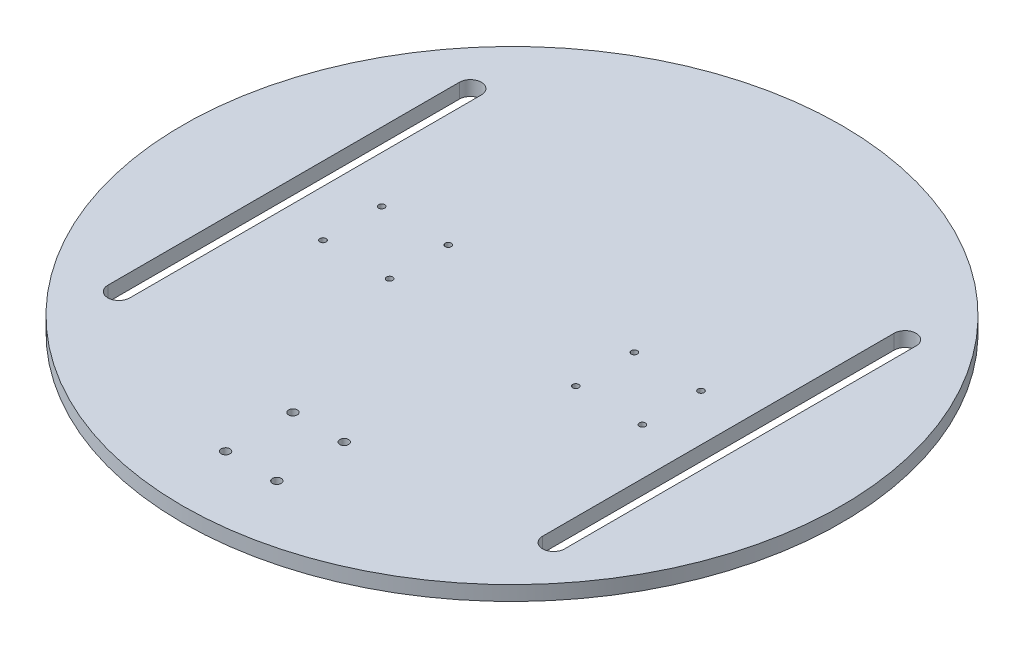
from build123d import *

# Parameters (mm, degrees)
SKETCH1_R           = 225
SKETCH1_R_2         = 3
BOSS_EXTRUDE1_DEPTH = 10
SKETCH3_R           = 2.1
CUT_EXTRUDE2_DEPTH  = 10


with BuildPart() as part:
    # Sketch1 → Boss-Extrude1 (new body)
    with BuildSketch(Plane(origin=(0, 0, 0), x_dir=(1, 0, 0), z_dir=(0, 1, 0))):
        with Locations(Location((0, 0, 0), (0, 0, 270))):
            Circle(SKETCH1_R)
        with Locations(Location((-17.5, -132.051038191, 0), (0, 0, 270))):
            Circle(SKETCH1_R_2, mode=Mode.SUBTRACT)
        with Locations(Location((17.5, -132.051038191, 0), (0, 0, 270))):
            Circle(SKETCH1_R_2, mode=Mode.SUBTRACT)
        with Locations(Location((17.5, -178.051038191, 0), (0, 0, 270))):
            Circle(SKETCH1_R_2, mode=Mode.SUBTRACT)
        with Locations(Location((-17.5, -178.051038191, 0), (0, 0, 270))):
            Circle(SKETCH1_R_2, mode=Mode.SUBTRACT)
        with BuildLine():
            Line((-155.90685468, -120), (-155.90685468, 120))
            ThreePointArc((-155.90685468, 120), (-148.40685468, 127.5), (-140.90685468, 120))
            Line((-140.90685468, 120), (-140.90685468, -120))
            ThreePointArc((-140.90685468, -120), (-148.40685468, -127.5), (-155.90685468, -120))
        make_face(mode=Mode.SUBTRACT)
        with BuildLine():
            Line((155.90685468, -120), (155.90685468, 120))
            ThreePointArc((155.90685468, 120), (148.40685468, 127.5), (140.90685468, 120))
            Line((140.90685468, 120), (140.90685468, -120))
            ThreePointArc((140.90685468, -120), (148.40685468, -127.5), (155.90685468, -120))
        make_face(mode=Mode.SUBTRACT)
    extrude(amount=BOSS_EXTRUDE1_DEPTH)

    # Sketch3 → Cut-Extrude2 (cut)
    with BuildSketch(Plane(origin=(0, 10, 0), x_dir=(1, 0, 0), z_dir=(0, 1, 0))):
        with Locations(Location((63.533017038, -20, 0), (0, 0, 270))):
            Circle(SKETCH3_R)
        with Locations(Location((63.533017038, 20, 0), (0, 0, 270))):
            Circle(SKETCH3_R)
        with Locations(Location((-63.533017038, -20, 0), (0, 0, 90))):
            Circle(SKETCH3_R)
        with Locations(Location((-109.034473384, -20, 0), (0, 0, 270))):
            Circle(SKETCH3_R)
        with Locations(Location((-63.533017038, 20, 0), (0, 0, 270))):
            Circle(SKETCH3_R)
        with Locations(Location((-109.034473384, 20, 0), (0, 0, 90))):
            Circle(SKETCH3_R)
        with Locations(Location((109.034473384, -20, 0), (0, 0, 90))):
            Circle(SKETCH3_R)
        with Locations(Location((109.034473384, 20, 0), (0, 0, 270))):
            Circle(SKETCH3_R)
    extrude(amount=-CUT_EXTRUDE2_DEPTH, mode=Mode.SUBTRACT)


solid = part.part
